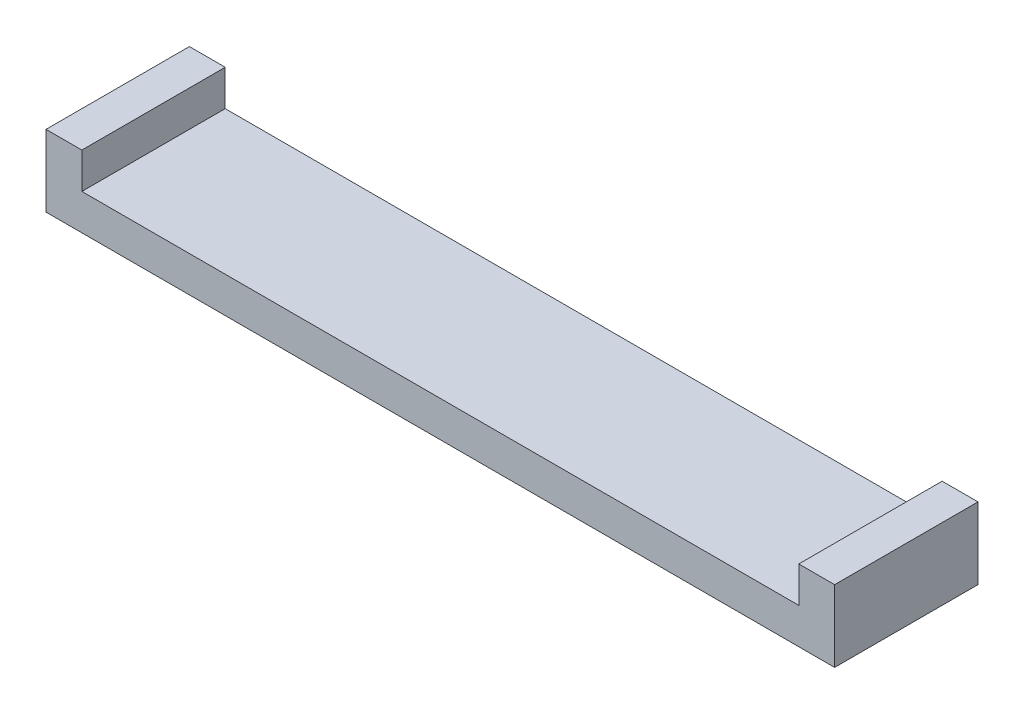
from build123d import *

# Parameters (mm, degrees)
BOSS_EXTRUDE1_DEPTH = 20


with BuildPart() as part:
    # Sketch1 → Boss-Extrude1 (new body)
    with BuildSketch(Plane.XY):
        Polygon((-5, -5), (105, -5), (105, 5), (100, 5), (100, 0), (0, 0), (0, 5), (-5, 5), align=None)
    extrude(amount=BOSS_EXTRUDE1_DEPTH)


solid = part.part
